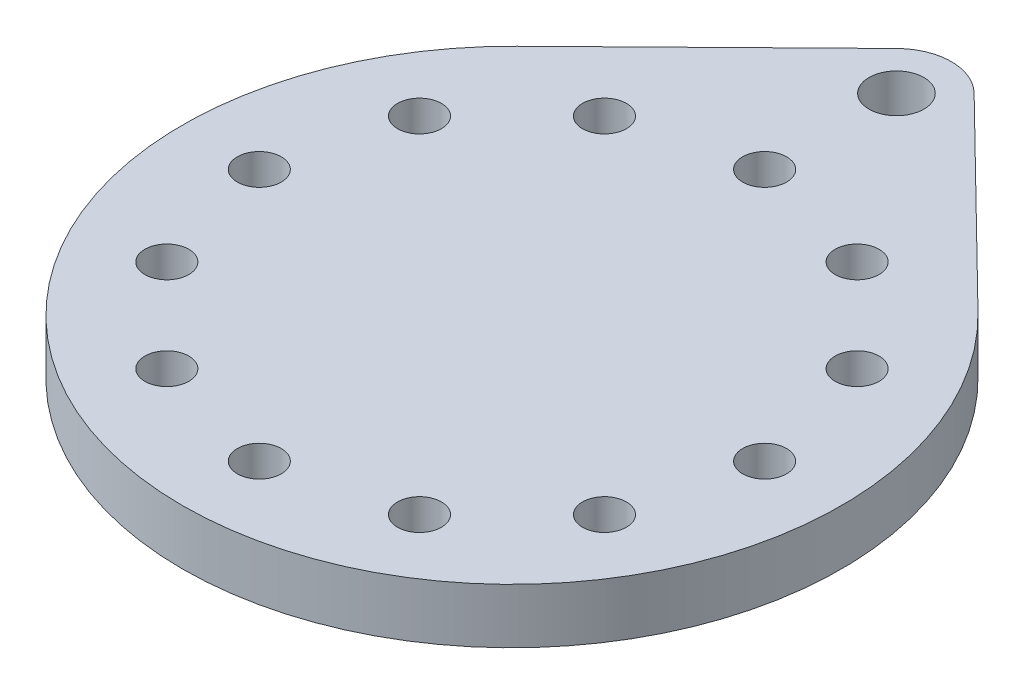
from build123d import *

# Parameters (mm, degrees)
SKETCH1_R           = 30
SKETCH1_R_2         = 2
SKETCH1_R_3         = 5
SKETCH1_R_4         = 2.5
BOSS_EXTRUDE1_DEPTH = 5


with BuildPart() as part:
    # Sketch1 → Boss-Extrude1 (new body)
    # profile 1 of 4: a face of its own
    with BuildSketch(Plane(origin=(0, 0, 0), x_dir=(1, 0, 0), z_dir=(0, 1, 0))):
        Circle(SKETCH1_R)
        with Locations(Location((-11.5, 19.918584287, 0), (0, 0, 270))):
            Circle(SKETCH1_R_2, mode=Mode.SUBTRACT)
        with Locations(Location((-19.918584287, 11.5, 0), (0, 0, 270))):
            Circle(SKETCH1_R_2, mode=Mode.SUBTRACT)
        with Locations(Location((-23, 0, 0), (0, 0, 270))):
            Circle(SKETCH1_R_2, mode=Mode.SUBTRACT)
        with Locations(Location((-19.918584287, -11.5, 0), (0, 0, 270))):
            Circle(SKETCH1_R_2, mode=Mode.SUBTRACT)
        with Locations(Location((-11.5, -19.918584287, 0), (0, 0, 270))):
            Circle(SKETCH1_R_2, mode=Mode.SUBTRACT)
        with Locations(Location((0, -23, 0), (0, 0, 270))):
            Circle(SKETCH1_R_2, mode=Mode.SUBTRACT)
        with Locations(Location((11.5, -19.918584287, 0), (0, 0, 270))):
            Circle(SKETCH1_R_2, mode=Mode.SUBTRACT)
        with Locations(Location((19.918584287, -11.5, 0), (0, 0, 270))):
            Circle(SKETCH1_R_2, mode=Mode.SUBTRACT)
        with Locations(Location((23, 0, 0), (0, 0, 270))):
            Circle(SKETCH1_R_2, mode=Mode.SUBTRACT)
        with Locations(Location((19.918584287, 11.5, 0), (0, 0, 270))):
            Circle(SKETCH1_R_2, mode=Mode.SUBTRACT)
        with Locations(Location((11.5, 19.918584287, 0), (0, 0, 270))):
            Circle(SKETCH1_R_2, mode=Mode.SUBTRACT)
        with Locations(Location((0, 23, 0), (0, 0, 270))):
            Circle(SKETCH1_R_2, mode=Mode.SUBTRACT)
    # profile 2 of 4: a face of its own
    with BuildSketch(Plane(origin=(0, 0, 0), x_dir=(1, 0, 0), z_dir=(0, 1, 0))):
        with BuildLine():
            Line((20.995626367, 21.428571429), (3.499271061, 38.571428571))
            ThreePointArc((3.499271061, 38.571428571), (4.609574563, 36.936962144), (5, 35))
            ThreePointArc((5, 35), (3.535533899, 31.464466087), (-1.9e-08, 30))
            ThreePointArc((-1.9e-08, 30), (11.338934182, 27.774602997), (20.995626367, 21.428571429))
        make_face()
    # profile 3 of 4: a face of its own
    with BuildSketch(Plane(origin=(0, 0, 0), x_dir=(1, 0, 0), z_dir=(0, 1, 0))):
        with BuildLine():
            ThreePointArc((-1.9e-08, 30), (-4.629100502, 33.110177644), (-3.499271061, 38.571428571))
            Line((-3.499271061, 38.571428571), (-20.995626367, 21.428571429))
            ThreePointArc((-20.995626367, 21.428571429), (-11.338934199, 27.77460299), (-1.9e-08, 30))
        make_face()
    # profile 4 of 4: a face of its own
    with BuildSketch(Plane(origin=(0, 0, 0), x_dir=(1, 0, 0), z_dir=(0, 1, 0))):
        with Locations((0, 35)):
            Circle(SKETCH1_R_3)
        with Locations(Location((0, 35, 0), (0, 0, 270))):
            Circle(SKETCH1_R_4, mode=Mode.SUBTRACT)
    extrude(amount=BOSS_EXTRUDE1_DEPTH)


solid = part.part
